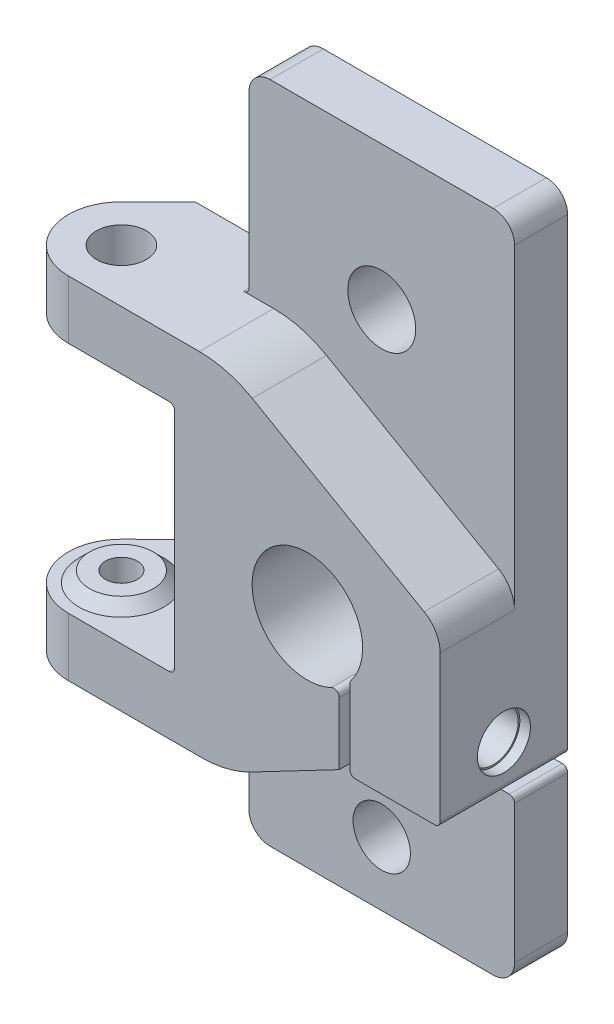
from build123d import *

# Parameters (mm, degrees)
SKETCH1_R                 = 2.7
SKETCH1_R_2               = 3.2
BOSS_EXTRUDE1_DEPTH       = 5
BOSS_EXTRUDE2_REACH       = 40.994
SKETCH3_R                 = 1.5
CUT_EXTRUDE1_DEPTH        = 57.535387148
FILLET1_R                 = 4.999497
FILLET2_R                 = 4.999497
SKETCH4_R                 = 3
BOSS_EXTRUDE3_DEPTH       = 1
DRAFT1_ANGLE              = 45
DRAFT1_OF_MIRROR1_2_ANGLE = 45
SKETCH5_R                 = 1.5
CUT_EXTRUDE2_DEPTH        = 57.535387148
SKETCH6_R                 = 3.1
CUT_EXTRUDE3_DEPTH        = 1.5
FILLET3_R                 = 10
FILLET5_R                 = 0.5
FILLET6_R                 = 2
FILLET7_R                 = 3
SKETCH8_R                 = 3.1
SKETCH8_R_2               = 2.35
BOSS_EXTRUDE4_DEPTH       = 1.5
CUT_EXTRUDE4_START        = -4
SKETCH9_R                 = 2.35
SKETCH9_R_2               = 1.5
CUT_EXTRUDE4_DEPTH        = 4


with BuildPart() as part:
    # Sketch1 → Boss-Extrude1 (new body)
    with BuildSketch(Plane.XY):
        with BuildLine():
            Line((5, -31.25), (5, 31.25))
            Line((5, 31.25), (-20, 31.25))
            Line((-20, 31.25), (-20, -14.75))
            Line((-20, -14.75), (-11.5, -14.75))
            Line((-11.5, -14.75), (-11.5, -7.072649545))
            ThreePointArc((-11.5, -7.072649545), (-3.96959369, 0.06788309), (-10.5, -7.997352116))
            Line((-10.5, -7.997352116), (-10.5, -15.75))
            Line((-10.5, -15.75), (-20, -15.75))
            Line((-20, -15.75), (-20, -31.25))
            Line((-20, -31.25), (5, -31.25))
        make_face()
        with Locations((-7.5, -25.25)):
            Circle(SKETCH1_R, mode=Mode.SUBTRACT)
        with Locations((-7.5, 17.75)):
            Circle(SKETCH1_R_2, mode=Mode.SUBTRACT)
    extrude(amount=BOSS_EXTRUDE1_DEPTH)

    # Boss-Extrude2: up to this face of the body (flat: up to its plane)
    boss_extrude2_end = Plane(part.part.faces().sort_by_distance((4.326854399, 0, 0))[0])
    # Sketch2 → Boss-Extrude2 (add, up to the picked face)
    with BuildSketch(Plane.XY.offset(12), mode=Mode.PRIVATE) as boss_extrude2_sk1:
        with BuildLine():
            Line((0, 12.75), (20, 12.75))
            Line((20, 12.75), (20, 7.25))
            Line((20, 7.25), (5, 7.25))
            Line((5, 7.25), (5, -14.75))
            Line((5, -14.75), (20, -14.75))
            Line((20, -14.75), (20, -20.25))
            Line((20, -20.25), (0, -20.25))
            Line((0, -20.25), (-10.5, -14.75))
            Line((-10.5, -14.75), (-10.5, -7.997352116))
            ThreePointArc((-10.5, -7.997352116), (-3.96959369, 0.06788309), (-11.5, -7.072649545))
            Line((-11.5, -7.072649545), (-11.5, -14.75))
            Line((-11.5, -14.75), (-20, -14.75))
            Line((-20, -14.75), (-20, 1.25))
            Line((-20, 1.25), (0, 12.75))
        make_face()
    boss_extrude2_tool1 = split(extrude(boss_extrude2_sk1.sketch, amount=-BOSS_EXTRUDE2_REACH, mode=Mode.PRIVATE), bisect_by=boss_extrude2_end, keep=Keep.BOTH, mode=Mode.PRIVATE)
    add(boss_extrude2_tool1.solids().sort_by(Axis((-1.249188, -4.122756, 12), (0, 0, -1)))[0])

    # Sketch3 → Cut-Extrude1 (cut, through all)
    with BuildSketch(Plane.XZ.offset(20.25)):
        with Locations(Location((15, 7, 0), (0, 0, 270))):
            Circle(SKETCH3_R)
        Polygon((15, 0), (20, 0), (20, 4.9), align=None)
    extrude(amount=-CUT_EXTRUDE1_DEPTH, mode=Mode.SUBTRACT)

    # Fillet1
    fillet1_edges = [part.edges().sort_by_distance(p)[0] for p in [
        (20, 10, 12),
        (20, 10, 4.9),
    ]]
    fillet(fillet1_edges, radius=FILLET1_R)

    # Fillet2
    fillet2_edges = [part.edges().sort_by_distance(p)[0] for p in [
        (20, -17.5, 12),
        (20, -17.5, 4.9),
    ]]
    fillet(fillet2_edges, radius=FILLET2_R)

    # Sketch4 → Boss-Extrude3 (add)
    with BuildSketch(Plane.XZ.offset(-7.25)):
        with Locations((15, 7)):
            Circle(SKETCH4_R)
    boss_extrude3 = extrude(amount=BOSS_EXTRUDE3_DEPTH)

    # Draft1
    draft1_faces = [part.faces().sort_by_distance(p)[0] for p in [
        (12, 6.75, 7),
    ]]
    draft(draft1_faces, Plane(origin=(15, 6.25, 7), x_dir=(-1, 0, 0), z_dir=(0, -1, 0)), DRAFT1_ANGLE)

    # Mirror1: Boss-Extrude3 across plane
    add(boss_extrude3.mirror(Plane.ZX.offset(-3.75)))

    # Draft1 of Mirror1 2
    draft1_of_mirror1_2_faces = [part.faces().sort_by_distance(p)[0] for p in [
        (12, -14.25, 7),
    ]]
    draft(draft1_of_mirror1_2_faces, Plane(origin=(15, -13.75, 7), x_dir=(-1, 0, 0), z_dir=(0, 1, 0)), DRAFT1_OF_MIRROR1_2_ANGLE)

    # Sketch5 → Cut-Extrude2 (cut, through all)
    with BuildSketch(Plane.XZ.offset(20.25)):
        with Locations(Location((15, 7, 0), (0, 0, 270))):
            Circle(SKETCH5_R)
    extrude(amount=-CUT_EXTRUDE2_DEPTH, mode=Mode.SUBTRACT)

    # Sketch6 → Cut-Extrude3 (cut)
    with BuildSketch(Plane.XZ.offset(20.25)):
        with Locations(Location((15, 7, 0), (0, 0, 270))):
            Circle(SKETCH6_R)
    cut_extrude3 = extrude(amount=-CUT_EXTRUDE3_DEPTH, mode=Mode.SUBTRACT)

    # Mirror2: Cut-Extrude3 across plane
    add(cut_extrude3.mirror(Plane.ZX.offset(-3.75)), mode=Mode.SUBTRACT)

    # Fillet3
    fillet3_edges = [part.edges().sort_by_distance(p)[0] for p in [
        (0, 12.75, 8.5),
        (0, -20.25, 8.5),
    ]]
    fillet(fillet3_edges, radius=FILLET3_R)

    # Fillet5
    fillet5_edges = [part.edges().sort_by_distance(p)[0] for p in [
        (-11.5, -7.072649545, 8.5),
        (-11.5, -14.75, 6),
        (-20, -14.75, 6),
        (-20, -15.75, 2.5),
        (-10.5, -7.997352116, 8.5),
        (5, 7.25, 6),
        (5, 12.75, 2.5),
        (5, -14.75, 6),
        (5, -20.25, 2.5),
    ]]
    fillet(fillet5_edges, radius=FILLET5_R)

    # Fillet6
    fillet6_edges = [part.edges().sort_by_distance(p)[0] for p in [
        (-20, 31.25, 2.5),
        (5, 31.25, 2.5),
        (5, -31.25, 2.5),
        (-20, -31.25, 2.5),
    ]]
    fillet(fillet6_edges, radius=FILLET6_R)

    # Fillet7
    fillet7_edges = [part.edges().sort_by_distance(p)[0] for p in [
        (-20, 1.25, 8.5),
    ]]
    fillet(fillet7_edges, radius=FILLET7_R)

    # Sketch7 → Cut-Revolve3 (revolve, cut)
    with BuildSketch(Plane.XY.offset(6), mode=Mode.PRIVATE) as cut_revolve3_sk:
        Polygon((5, -10.75), (5, -7.5), (2, -7.5), (2, -9), (-15, -9), (-15, -8.4), (-19, -8.4), (-19, -8.25), (-20, -8.25), (-20, -10.75), align=None)
    revolve(cut_revolve3_sk.sketch.rotate(Axis((-28.80218061, -10.75, 6), (1, 0, 0)), 90), axis=Axis((-28.80218061, -10.75, 6), (1, 0, 0)), mode=Mode.SUBTRACT)

    # Sketch8 → Boss-Extrude4 (add)
    with BuildSketch(Plane(origin=(0, 12.75, 0), x_dir=(1, 0, 0), z_dir=(0, 1, 0))):
        with Locations(Location((15, -7, 0), (0, 0, 90))):
            Circle(SKETCH8_R)
        with Locations(Location((15, -7, 0), (0, 0, 270))):
            Circle(SKETCH8_R_2, mode=Mode.SUBTRACT)
    extrude(amount=-BOSS_EXTRUDE4_DEPTH)

    # Sketch9 → Cut-Extrude4 (cut)
    with BuildSketch(Plane(origin=(0, 11.25, 0), x_dir=(1, 0, 0), z_dir=(0, 1, 0)).offset(CUT_EXTRUDE4_START)):
        with Locations(Location((15, -7, 0), (0, 0, 270))):
            Circle(SKETCH9_R)
        with Locations((15, -7)):
            Circle(SKETCH9_R_2, mode=Mode.SUBTRACT)
    extrude(amount=CUT_EXTRUDE4_DEPTH, mode=Mode.SUBTRACT)


with BuildPart() as body_2:
    # Mirror3: mirrored copy
    add(part.part.mirror(Plane(origin=(0, 0, 0), x_dir=(0, 0, 1), z_dir=(1, 0, 0))))


solid = body_2.part
